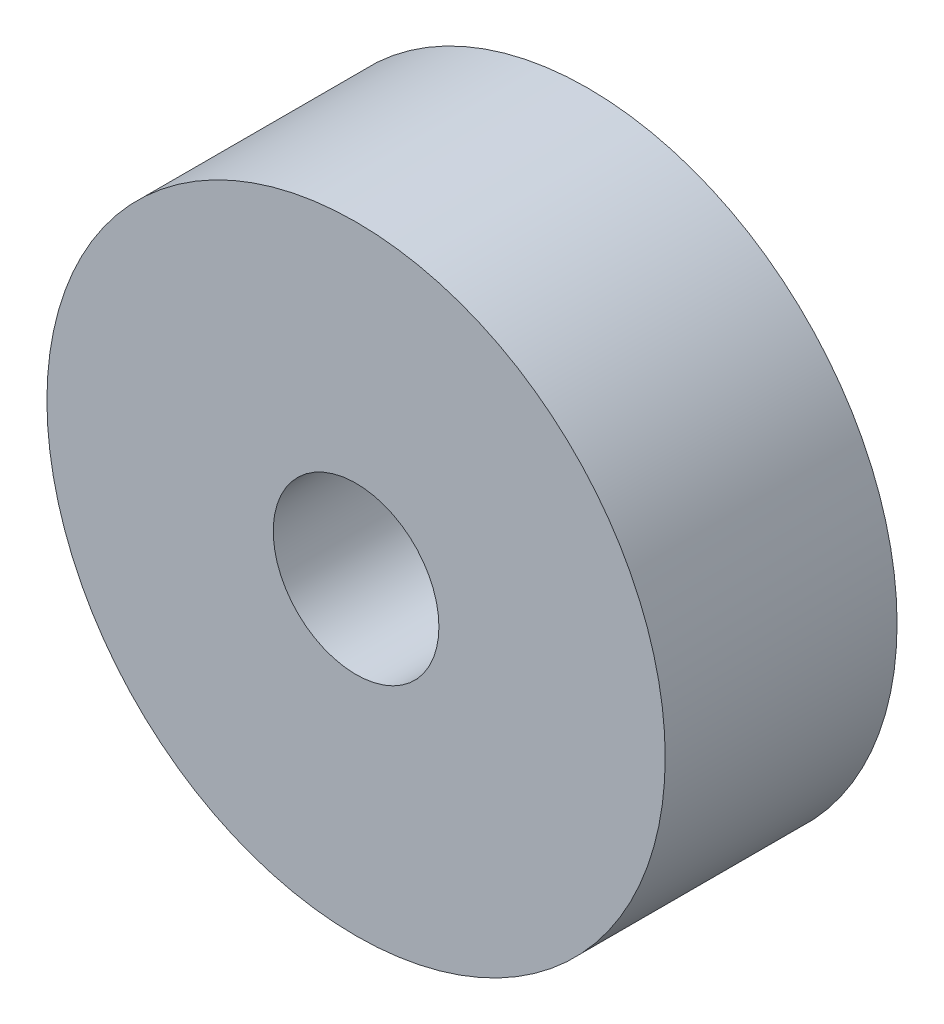
from build123d import *

# Parameters (mm, degrees)
SKETCH3_R           = 40
BOSS_EXTRUDE2_DEPTH = 30
SKETCH4_R           = 10.7200241
CUT_EXTRUDE1_DEPTH  = 30


with BuildPart() as part:
    # Sketch3 → Boss-Extrude2 (new body)
    with BuildSketch(Plane.XY):
        Circle(SKETCH3_R)
    extrude(amount=BOSS_EXTRUDE2_DEPTH)

    # Sketch4 → Cut-Extrude1 (cut)
    with BuildSketch(Plane.XY.offset(30)):
        Circle(SKETCH4_R)
    extrude(amount=-CUT_EXTRUDE1_DEPTH, mode=Mode.SUBTRACT)


solid = part.part
